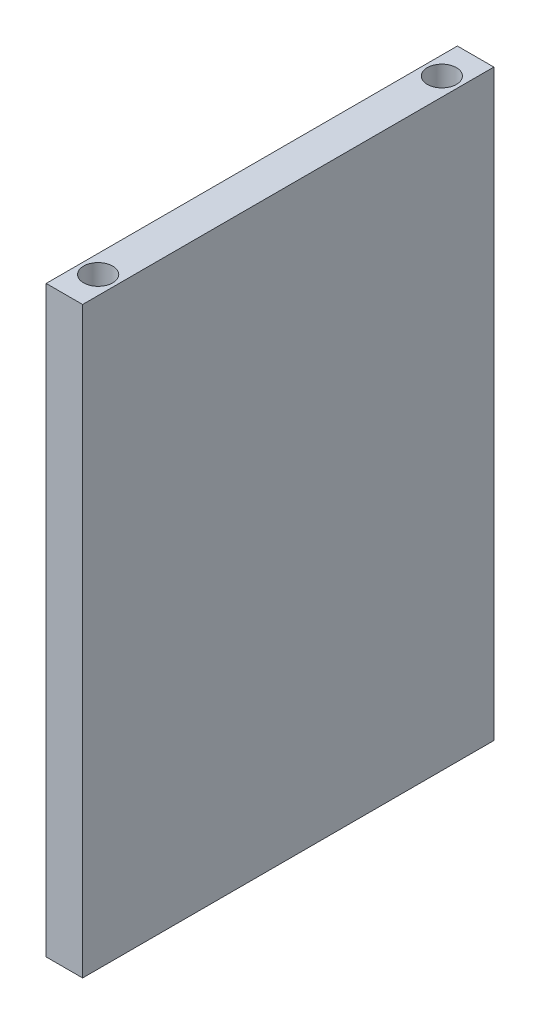
from build123d import *

# Parameters (mm, degrees)
SZKIC1_W                    = 56.4
SZKIC1_H                    = 80
DODANIE_WYCI_GNI_CIE1_DEPTH = 5
OTWORY_USTALAJ_CE_4_0MM1_D  = 4


with BuildPart() as part:
    # Szkic1 → Dodanie-wyciągnięcie1 (new body)
    with BuildSketch(Plane(origin=(0, 0, 0), x_dir=(0, 0, -1), z_dir=(1, 0, 0))):
        with Locations((28.2, 40)):
            Rectangle(SZKIC1_W, SZKIC1_H)
    extrude(amount=DODANIE_WYCI_GNI_CIE1_DEPTH)

    # Otwory ustalające Ø4.0mm1 (through all)
    with Locations(Plane(origin=(2.5, 80, -51.77), x_dir=(0, 0, 1), z_dir=(0, 1, 0))):
        with Locations((0, 0), (47.14, 0)):
            Hole(OTWORY_USTALAJ_CE_4_0MM1_D / 2)


solid = part.part
